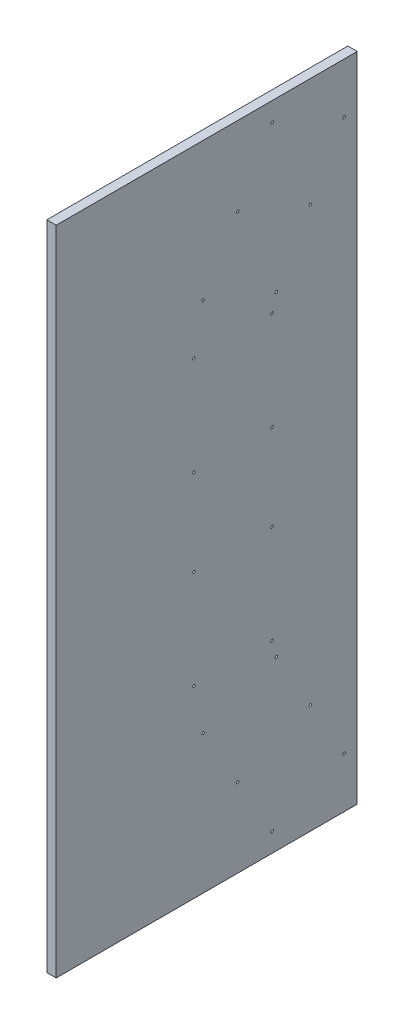
from build123d import *

# Parameters (mm, degrees)
SKETCH2_W           = 1321
SKETCH2_H           = 610
SKETCH2_R           = 2.5
BOSS_EXTRUDE1_DEPTH = 19.05


with BuildPart() as part:
    # Sketch2 → Boss-Extrude1 (new body)
    with BuildSketch(Plane.YZ):
        with Locations((0.75, 0.165708265)):
            Rectangle(SKETCH2_W, SKETCH2_H)
        with Locations(Location((558.77766677, -278.265003699, 0), (0, 0, 90))):
            Circle(SKETCH2_R, mode=Mode.SUBTRACT)
        with Locations(Location((439.87237883, -209.615003699, 0), (0, 0, 90))):
            Circle(SKETCH2_R, mode=Mode.SUBTRACT)
        with Locations(Location((320.967090891, -140.965003699, 0), (0, 0, 90))):
            Circle(SKETCH2_R, mode=Mode.SUBTRACT)
        with Locations(Location((622.950729306, -132.51399891, 0), (0, 0, 90))):
            Circle(SKETCH2_R, mode=Mode.SUBTRACT)
        with Locations(Location((501.707172776, -62.51399891, 0), (0, 0, 90))):
            Circle(SKETCH2_R, mode=Mode.SUBTRACT)
        with Locations(Location((380.463616246, 7.48600109, 0), (0, 0, 90))):
            Circle(SKETCH2_R, mode=Mode.SUBTRACT)
        with Locations(Location((288.05, 26.165708265, 0), (0, 0, 90))):
            Circle(SKETCH2_R, mode=Mode.SUBTRACT)
        with Locations(Location((288.05, -132.144895778, 0), (0, 0, 90))):
            Circle(SKETCH2_R, mode=Mode.SUBTRACT)
        with Locations(Location((88.05, -132.144895778, 0), (0, 0, 90))):
            Circle(SKETCH2_R, mode=Mode.SUBTRACT)
        with Locations(Location((88.05, 26.165708265, 0), (0, 0, 90))):
            Circle(SKETCH2_R, mode=Mode.SUBTRACT)
        with Locations(Location((-86.55, -132.144895778, 0), (0, 0, 90))):
            Circle(SKETCH2_R, mode=Mode.SUBTRACT)
        with Locations(Location((-86.55, 26.165708265, 0), (0, 0, 90))):
            Circle(SKETCH2_R, mode=Mode.SUBTRACT)
        with Locations(Location((-286.55, 26.165708265, 0), (0, 0, 90))):
            Circle(SKETCH2_R, mode=Mode.SUBTRACT)
        with Locations(Location((-286.55, -132.144895778, 0), (0, 0, 90))):
            Circle(SKETCH2_R, mode=Mode.SUBTRACT)
        with Locations(Location((-557.27766677, -278.265003699, 0), (0, 0, 90))):
            Circle(SKETCH2_R, mode=Mode.SUBTRACT)
        with Locations(Location((-438.37237883, -209.615003699, 0), (0, 0, 90))):
            Circle(SKETCH2_R, mode=Mode.SUBTRACT)
        with Locations(Location((-319.467090891, -140.965003699, 0), (0, 0, 90))):
            Circle(SKETCH2_R, mode=Mode.SUBTRACT)
        with Locations(Location((-378.963616246, 7.48600109, 0), (0, 0, 90))):
            Circle(SKETCH2_R, mode=Mode.SUBTRACT)
        with Locations(Location((-500.207172776, -62.51399891, 0), (0, 0, 90))):
            Circle(SKETCH2_R, mode=Mode.SUBTRACT)
        with Locations(Location((-621.450729306, -132.51399891, 0), (0, 0, 90))):
            Circle(SKETCH2_R, mode=Mode.SUBTRACT)
    extrude(amount=BOSS_EXTRUDE1_DEPTH)


solid = part.part
